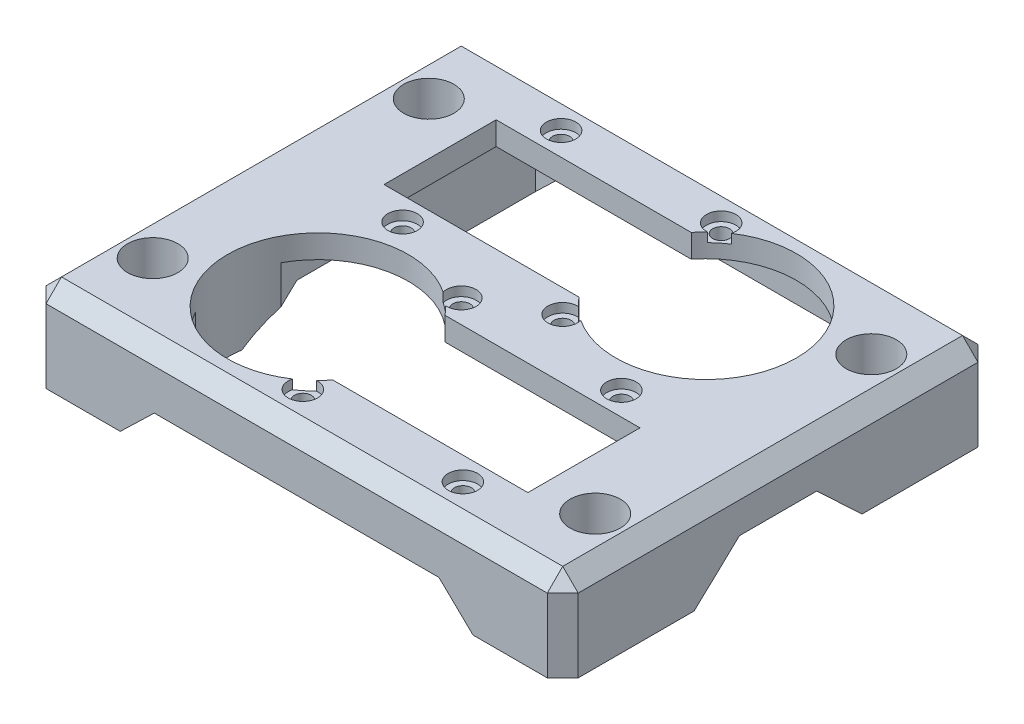
from build123d import *

# Parameters (mm, degrees)
ESQUISSE1_W                                        = 53.8
ESQUISSE1_H                                        = 51.7
ESQUISSE1_R                                        = 1.1
BOSS_EXTRU_1_DEPTH                                 = 3
CHAMBRAGE_POUR_VIS_SIX_PANS_CREUX_M1_6_D           = 2.2
CHAMBRAGE_POUR_VIS_SIX_PANS_CREUX_M1_6_CBORE_D     = 3.8
CHAMBRAGE_POUR_VIS_SIX_PANS_CREUX_M1_6_CBORE_DEPTH = 1.2
BOSS_EXTRU_2_START                                 = 16
ESQUISSE4_W                                        = 7.51
ESQUISSE4_H                                        = 51.7
BOSS_EXTRU_2_DEPTH                                 = 19
ESQUISSE6_R                                        = 1.6
ENL_V_MAT_EXTRU_2_DEPTH                            = 62.22146764
CHAMBRAGE_POUR_VIS_SIX_PANS_CREUX_M31_D            = 3.2
CHAMBRAGE_POUR_VIS_SIX_PANS_CREUX_M31_CBORE_D      = 6.5
CHAMBRAGE_POUR_VIS_SIX_PANS_CREUX_M31_CBORE_DEPTH  = 7
ENL_V_MAT_EXTRU_3_DEPTH                            = 77.075175977
ENL_V_MAT_EXTRU_3_DEPTH_BACK                       = 77.075175977
BOSS_EXTRU_3_DEPTH                                 = 2
CHANFREIN1_SIZE                                    = 2


with BuildPart() as part:
    # Esquisse1 → Boss.-Extru.1 (new body)
    with BuildSketch(Plane(origin=(0, 0, 0), x_dir=(1, 0, 0), z_dir=(0, 1, 0))):
        with Locations((16.5, -2.35)):
            Rectangle(ESQUISSE1_W, ESQUISSE1_H)
        with Locations(Location((12.3, -25.2, 0), (0, 0, 270))):
            Circle(ESQUISSE1_R, mode=Mode.SUBTRACT)
        with BuildLine():
            ThreePointArc((13.170256267, -22.2), (-7.69, -14.95), (13.170256267, -7.7))
            Line((13.170256267, -7.7), (38.4, -7.7))
            Line((38.4, -7.7), (38.4, -22.2))
            Line((38.4, -22.2), (13.170256267, -22.2))
        make_face(mode=Mode.SUBTRACT)
        with Locations(Location((12.3, -4.7, 0), (0, 0, 270))):
            Circle(ESQUISSE1_R, mode=Mode.SUBTRACT)
        with Locations(Location((33, -25.2, 0), (0, 0, 270))):
            Circle(ESQUISSE1_R, mode=Mode.SUBTRACT)
        with Locations(Location((33, -4.7, 0), (0, 0, 270))):
            Circle(ESQUISSE1_R, mode=Mode.SUBTRACT)
        with Locations(Location((0, 0, 0), (0, 0, 270))):
            Circle(ESQUISSE1_R, mode=Mode.SUBTRACT)
        with Locations(Location((0, 20.5, 0), (0, 0, 270))):
            Circle(ESQUISSE1_R, mode=Mode.SUBTRACT)
        with Locations(Location((20.7, 0, 0), (0, 0, 270))):
            Circle(ESQUISSE1_R, mode=Mode.SUBTRACT)
        with BuildLine():
            Line((-5.4, 3), (-5.4, 17.5))
            Line((-5.4, 17.5), (19.829743733, 17.5))
            ThreePointArc((19.829743733, 17.5), (32.837694897, 21.29211021), (40.69, 10.25))
            ThreePointArc((40.69, 10.25), (32.837694897, -0.79211021), (19.829743733, 3))
            Line((19.829743733, 3), (-5.4, 3))
        make_face(mode=Mode.SUBTRACT)
        with Locations(Location((20.7, 20.5, 0), (0, 0, 270))):
            Circle(ESQUISSE1_R, mode=Mode.SUBTRACT)
    extrude(amount=BOSS_EXTRU_1_DEPTH)

    # Chambrage pour vis à six pans creux M1.61 (through all)
    with Locations(Plane(origin=(0, 3, 0), x_dir=(1, 0, 0), z_dir=(0, 1, 0))):
        with Locations((0, 20.5), (20.7, 20.5), (20.7, 0), (12.3, -4.7), (0, 0), (33, -4.7), (12.3, -25.2), (33, -25.2)):
            CounterBoreHole(CHAMBRAGE_POUR_VIS_SIX_PANS_CREUX_M1_6_D / 2, CHAMBRAGE_POUR_VIS_SIX_PANS_CREUX_M1_6_CBORE_D / 2, CHAMBRAGE_POUR_VIS_SIX_PANS_CREUX_M1_6_CBORE_DEPTH)

    # Esquisse4 → Boss.-Extru.2 (add)
    with BuildSketch(Plane.XZ.offset(BOSS_EXTRU_2_START)):
        with BuildLine():
            Line((-6.31, 28.2), (-10.4, 28.2))
            Line((-10.4, 28.2), (-10.4, -23.5))
            Line((-10.4, -23.5), (-6.31, -23.5))
            Line((-6.31, -23.5), (-6.31, 9.440009074))
            ThreePointArc((-6.31, 9.440009074), (-7.69, 14.95), (-6.31, 20.459990926))
            Line((-6.31, 20.459990926), (-6.31, 28.2))
        make_face()
        with Locations((-14.155, 2.35)):
            Rectangle(ESQUISSE4_W, ESQUISSE4_H)
        with BuildLine():
            Line((39.31, 28.2), (50.91, 28.2))
            Line((50.91, 28.2), (50.91, -23.5))
            Line((50.91, -23.5), (39.31, -23.5))
            Line((39.31, -23.5), (39.31, -15.759990926))
            ThreePointArc((39.31, -15.759990926), (40.69, -10.25), (39.31, -4.740009074))
            Line((39.31, -4.740009074), (39.31, 28.2))
        make_face()
    extrude(amount=-BOSS_EXTRU_2_DEPTH)

    # Esquisse6 → Enlèv. mat.-Extru.2 (cut, through all)
    with BuildSketch(Plane(origin=(0, 3, 0), x_dir=(1, 0, 0), z_dir=(0, 1, 0))):
        with Locations(Location((-12.11, 15.5, 0), (0, 0, 270))):
            Circle(ESQUISSE6_R)
        with Locations(Location((-12.11, -20.2, 0), (0, 0, 90))):
            Circle(ESQUISSE6_R)
        with Locations(Location((45.11, -20.2, 0), (0, 0, 270))):
            Circle(ESQUISSE6_R)
        with Locations(Location((45.11, 15.5, 0), (0, 0, 90))):
            Circle(ESQUISSE6_R)
    extrude(amount=-ENL_V_MAT_EXTRU_2_DEPTH, mode=Mode.SUBTRACT)

    # Chambrage pour vis à six pans creux M31 (through all)
    with Locations(Plane(origin=(0, 3, 0), x_dir=(1, 0, 0), z_dir=(0, 1, 0))):
        with Locations((-12.11, 15.5), (-12.11, -20.2), (45.11, 15.5), (45.11, -20.2)):
            CounterBoreHole(CHAMBRAGE_POUR_VIS_SIX_PANS_CREUX_M31_D / 2, CHAMBRAGE_POUR_VIS_SIX_PANS_CREUX_M31_CBORE_D / 2, CHAMBRAGE_POUR_VIS_SIX_PANS_CREUX_M31_CBORE_DEPTH)

    # Esquisse9 → Enlèv. mat.-Extru.3 (cut, two sides: drawn at the far end of the back side and taken through both)
    with BuildSketch(Plane.ZY.offset(17.91).offset(-ENL_V_MAT_EXTRU_3_DEPTH_BACK)):
        Polygon((-23.5, -8.5), (-8.5, -8.5), (-2.65, -3), (7.35, -3), (13.2, -8.5), (28.2, -8.5), (28.2, -16), (-23.5, -16), align=None)
    extrude(amount=ENL_V_MAT_EXTRU_3_DEPTH + ENL_V_MAT_EXTRU_3_DEPTH_BACK, mode=Mode.SUBTRACT)

    # Esquisse10 → Boss.-Extru.3 (add)
    with BuildSketch(Plane.XY.offset(28.2)):
        Polygon((-6.31, -8.5), (-1.905, -4.25), (34.905, -4.25), (39.31, -8.5), (50.91, -8.5), (50.91, 3), (-17.91, 3), (-17.91, -8.5), align=None)
    boss_extru_3 = extrude(amount=BOSS_EXTRU_3_DEPTH)

    # Symétrie1: Boss.-Extru.3 across plane
    add(boss_extru_3.mirror(Plane.XY.offset(2.35)))

    # Chanfrein1
    chanfrein1_edges = [part.edges().sort_by_distance(p)[0] for p in [
        (-17.91, 3, 2.35),
        (50.91, 3, 2.35),
        (50.91, -2.75, 30.2),
        (16.5, 3, 30.2),
        (-17.91, -2.75, 30.2),
        (-17.91, -2.75, -25.5),
        (16.5, 3, -25.5),
        (50.91, -2.75, -25.5),
    ]]
    chamfer(chanfrein1_edges, length=CHANFREIN1_SIZE)


solid = part.part
